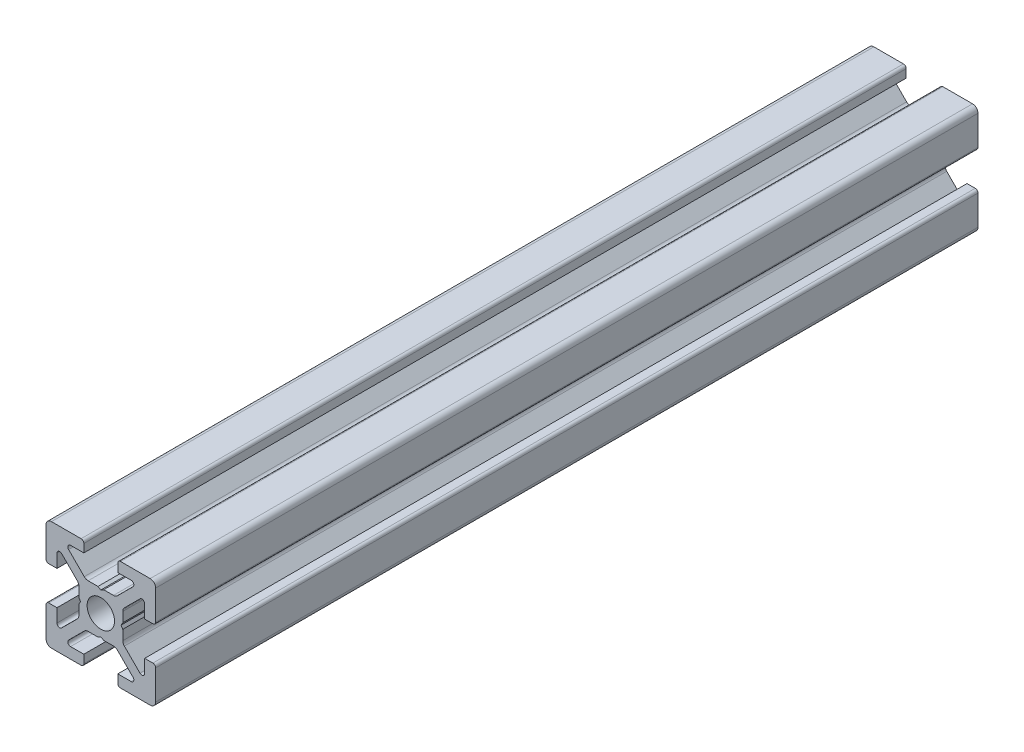
from build123d import *

# Parameters (mm, degrees)
SKETCH_1_R      = 2.5
EXTRUDE_1_DEPTH = 150


with BuildPart() as part:
    # 草图1 → 凸台-拉伸1 (new body)
    with BuildSketch(Plane.XY):
        with BuildLine():
            Line((16.486773435, 27.123343944), (19.340326826, 24.269790554))
            ThreePointArc((19.340326826, 24.269790554), (19.885221932, 24.161404178), (20.193880216, 24.623343944))
            Line((20.193880216, 24.623343944), (20.193880216, 27.043444957))
            Line((20.193880216, 27.043444957), (21.693880216, 27.043444957))
            ThreePointArc((21.693880216, 27.043444957), (22.047433607, 26.896998348), (22.193880216, 26.543444957))
            Line((22.193880216, 26.543444957), (22.193880216, 21.143444957))
            ThreePointArc((22.193880216, 21.143444957), (21.900986997, 20.436338176), (21.193880216, 20.143444957))
            Line((21.193880216, 20.143444957), (15.793880216, 20.143444957))
            ThreePointArc((15.793880216, 20.143444957), (15.440326826, 20.289891566), (15.293880216, 20.643444957))
            Line((15.293880216, 20.643444957), (15.293880216, 22.143444957))
            Line((15.293880216, 22.143444957), (17.713981229, 22.143444957))
            ThreePointArc((17.713981229, 22.143444957), (18.175920995, 22.452103241), (18.06753462, 22.996998348))
            Line((18.06753462, 22.996998348), (15.213981229, 25.850551738))
            ThreePointArc((15.213981229, 25.850551738), (14.88955788, 26.06732449), (14.506874448, 26.143444957))
            Line((14.506874448, 26.143444957), (12.713495459, 26.143444957))
            Line((12.713495459, 26.143444957), (12.193880216, 26.443444957))
            Line((12.193880216, 26.443444957), (11.674264974, 26.143444957))
            Line((11.674264974, 26.143444957), (9.880885985, 26.143444957))
            ThreePointArc((9.880885985, 26.143444957), (9.498202552, 26.06732449), (9.173779204, 25.850551738))
            Line((9.173779204, 25.850551738), (6.320225813, 22.996998348))
            ThreePointArc((6.320225813, 22.996998348), (6.211839437, 22.452103241), (6.673779204, 22.143444957))
            Line((6.673779204, 22.143444957), (9.093880216, 22.143444957))
            Line((9.093880216, 22.143444957), (9.093880216, 20.643444957))
            ThreePointArc((9.093880216, 20.643444957), (8.947433607, 20.289891566), (8.593880216, 20.143444957))
            Line((8.593880216, 20.143444957), (3.193880216, 20.143444957))
            ThreePointArc((3.193880216, 20.143444957), (2.486773435, 20.436338176), (2.193880216, 21.143444957))
            Line((2.193880216, 21.143444957), (2.193880216, 26.543444957))
            ThreePointArc((2.193880216, 26.543444957), (2.340326826, 26.896998348), (2.693880216, 27.043444957))
            Line((2.693880216, 27.043444957), (4.193880216, 27.043444957))
            Line((4.193880216, 27.043444957), (4.193880216, 24.623343944))
            ThreePointArc((4.193880216, 24.623343944), (4.5025385, 24.161404178), (5.047433607, 24.269790554))
            Line((5.047433607, 24.269790554), (7.900986997, 27.123343944))
            ThreePointArc((7.900986997, 27.123343944), (8.117759749, 27.447767293), (8.193880216, 27.830450726))
            Line((8.193880216, 27.830450726), (8.193880216, 29.623829715))
            Line((8.193880216, 29.623829715), (8.493880216, 30.143444957))
            Line((8.493880216, 30.143444957), (8.193880216, 30.663060199))
            Line((8.193880216, 30.663060199), (8.193880216, 32.456439189))
            ThreePointArc((8.193880216, 32.456439189), (8.117759749, 32.839122621), (7.900986997, 33.16354597))
            Line((7.900986997, 33.16354597), (5.047433607, 36.01709936))
            ThreePointArc((5.047433607, 36.01709936), (4.5025385, 36.125485736), (4.193880216, 35.66354597))
            Line((4.193880216, 35.66354597), (4.193880216, 33.243444957))
            Line((4.193880216, 33.243444957), (2.693880216, 33.243444957))
            ThreePointArc((2.693880216, 33.243444957), (2.340326826, 33.389891566), (2.193880216, 33.743444957))
            Line((2.193880216, 33.743444957), (2.193880216, 39.143444957))
            ThreePointArc((2.193880216, 39.143444957), (2.486773435, 39.850551738), (3.193880216, 40.143444957))
            Line((3.193880216, 40.143444957), (8.593880216, 40.143444957))
            ThreePointArc((8.593880216, 40.143444957), (8.947433607, 39.996998348), (9.093880216, 39.643444957))
            Line((9.093880216, 39.643444957), (9.093880216, 38.143444957))
            Line((9.093880216, 38.143444957), (6.673779204, 38.143444957))
            ThreePointArc((6.673779204, 38.143444957), (6.211839437, 37.834786673), (6.320225813, 37.289891566))
            Line((6.320225813, 37.289891566), (9.173779204, 34.436338176))
            ThreePointArc((9.173779204, 34.436338176), (9.498202552, 34.219565425), (9.880885985, 34.143444957))
            Line((9.880885985, 34.143444957), (11.674264974, 34.143444957))
            Line((11.674264974, 34.143444957), (12.193880216, 33.843444957))
            Line((12.193880216, 33.843444957), (12.713495459, 34.143444957))
            Line((12.713495459, 34.143444957), (14.506874448, 34.143444957))
            ThreePointArc((14.506874448, 34.143444957), (14.88955788, 34.219565425), (15.213981229, 34.436338176))
            Line((15.213981229, 34.436338176), (18.06753462, 37.289891566))
            ThreePointArc((18.06753462, 37.289891566), (18.175920995, 37.834786673), (17.713981229, 38.143444957))
            Line((17.713981229, 38.143444957), (15.293880216, 38.143444957))
            Line((15.293880216, 38.143444957), (15.293880216, 39.643444957))
            ThreePointArc((15.293880216, 39.643444957), (15.440326826, 39.996998348), (15.793880216, 40.143444957))
            Line((15.793880216, 40.143444957), (21.193880216, 40.143444957))
            ThreePointArc((21.193880216, 40.143444957), (21.900986997, 39.850551738), (22.193880216, 39.143444957))
            Line((22.193880216, 39.143444957), (22.193880216, 33.743444957))
            ThreePointArc((22.193880216, 33.743444957), (22.047433607, 33.389891566), (21.693880216, 33.243444957))
            Line((21.693880216, 33.243444957), (20.193880216, 33.243444957))
            Line((20.193880216, 33.243444957), (20.193880216, 35.66354597))
            ThreePointArc((20.193880216, 35.66354597), (19.885221932, 36.125485736), (19.340326826, 36.01709936))
            Line((19.340326826, 36.01709936), (16.486773435, 33.16354597))
            ThreePointArc((16.486773435, 33.16354597), (16.270000684, 32.839122621), (16.193880216, 32.456439189))
            Line((16.193880216, 32.456439189), (16.193880216, 30.663060199))
            Line((16.193880216, 30.663060199), (15.893880216, 30.143444957))
            Line((15.893880216, 30.143444957), (16.193880216, 29.623829715))
            Line((16.193880216, 29.623829715), (16.193880216, 27.830450726))
            ThreePointArc((16.193880216, 27.830450726), (16.270000684, 27.447767293), (16.486773435, 27.123343944))
        make_face()
        with Locations((12.193880216, 30.143444957)):
            Circle(SKETCH_1_R, mode=Mode.SUBTRACT)
    extrude(amount=EXTRUDE_1_DEPTH)


solid = part.part
